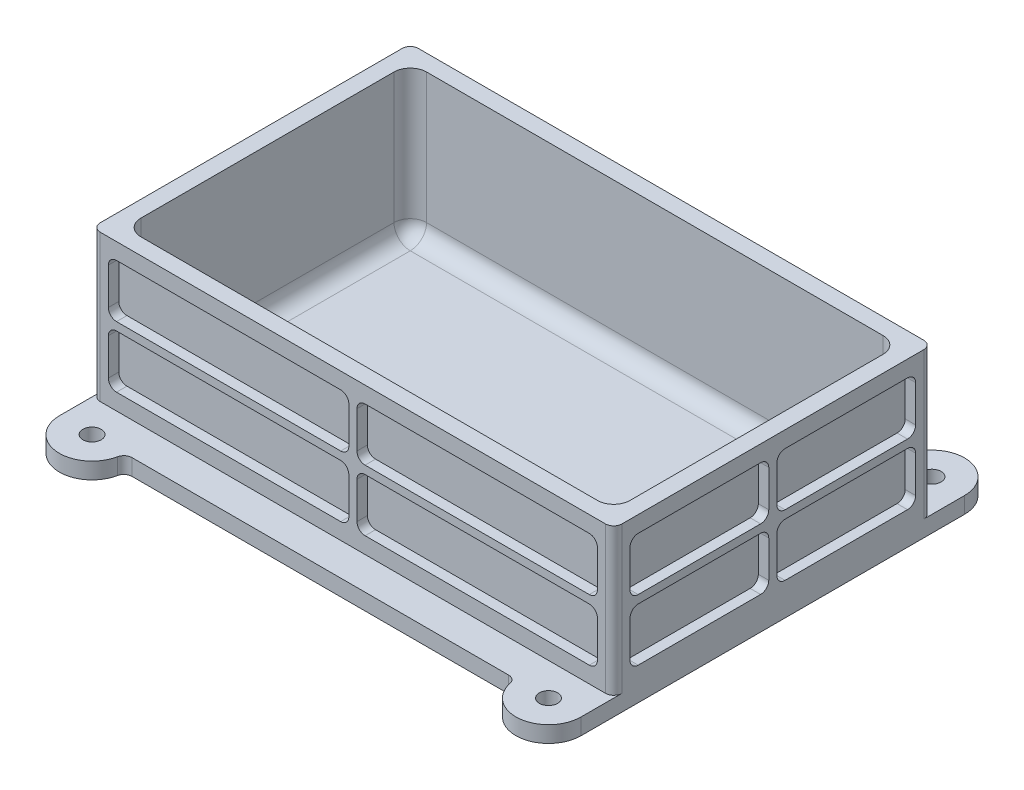
from build123d import *

# Parameters (mm, degrees)
SKETCH2_W                = 203.2
SKETCH2_H                = 123.952
MAIN_BLOCK_DEPTH         = 63.5
SHELL_T                  = -6.35
SKETCH6_W                = 203.2
SKETCH6_H                = 25.4
SKETCH6_R                = 3.5687
MOUNTING_FLANGES_DEPTH   = 6.35
SKETCH7_W                = 93.6625
SKETCH7_H                = 20.6375
LONG_SIDE_RIBBING_DEPTH  = 4.064
SKETCH8_W                = 54.0385
SKETCH8_H                = 20.6375
SHORT_SIDE_RIBBING_DEPTH = 4.064
CUT_EXTRUDE3_DEPTH       = 146.682009445
EXTERNAL_FILLETS_R       = 3.175
INTERNAL_FILLETS_R       = 6.35


with BuildPart() as part:
    # Sketch2 → Main Block (new body)
    with BuildSketch(Plane(origin=(0, 0, 0), x_dir=(1, 0, 0), z_dir=(0, 1, 0))):
        Rectangle(SKETCH2_W, SKETCH2_H)
    extrude(amount=MAIN_BLOCK_DEPTH)

    # Shell
    shell_openings = [part.faces().sort_by_distance(p)[0] for p in [
        (0, 63.5, 0),
    ]]
    offset(amount=SHELL_T, openings=shell_openings, kind=Kind.INTERSECTION)

    # Sketch6 → Mounting Flanges (add)
    # profile 1 of 2: a face of its own
    with BuildSketch(Plane(origin=(0, 6.35, 0), x_dir=(1, 0, 0), z_dir=(0, 1, 0))):
        with Locations((0, 74.676)):
            Rectangle(SKETCH6_W, SKETCH6_H)
        with Locations(Location((-88.9, 74.676, 0), (0, 0, 270))):
            Circle(SKETCH6_R, mode=Mode.SUBTRACT)
        with Locations(Location((88.9, 74.676, 0), (0, 0, 270))):
            Circle(SKETCH6_R, mode=Mode.SUBTRACT)
    # profile 2 of 2: a face of its own
    with BuildSketch(Plane(origin=(0, 6.35, 0), x_dir=(1, 0, 0), z_dir=(0, 1, 0))):
        with Locations((0, -74.676)):
            Rectangle(SKETCH6_W, SKETCH6_H)
        with Locations(Location((88.9, -74.676, 0), (0, 0, 270))):
            Circle(SKETCH6_R, mode=Mode.SUBTRACT)
        with Locations(Location((-88.9, -74.676, 0), (0, 0, 270))):
            Circle(SKETCH6_R, mode=Mode.SUBTRACT)
    extrude(amount=-MOUNTING_FLANGES_DEPTH)

    # Sketch7 → Long Side Ribbing (cut)
    with BuildSketch(Plane.XY.offset(61.976)):
        with Locations((-48.41875, 46.83125)):
            Rectangle(SKETCH7_W, SKETCH7_H)
        with Locations((-48.41875, 23.01875)):
            Rectangle(SKETCH7_W, SKETCH7_H)
        with Locations((48.41875, 46.83125)):
            Rectangle(SKETCH7_W, SKETCH7_H)
        with Locations((48.41875, 23.01875)):
            Rectangle(SKETCH7_W, SKETCH7_H)
    long_side_ribbing = extrude(amount=-LONG_SIDE_RIBBING_DEPTH, mode=Mode.SUBTRACT)

    # Mirror1: Long Side Ribbing across plane
    add(long_side_ribbing.mirror(Plane.XY), mode=Mode.SUBTRACT)

    # Sketch8 → Short Side Ribbing (cut)
    with BuildSketch(Plane(origin=(101.6, 0, 0), x_dir=(0, 0, -1), z_dir=(1, 0, 0))):
        with Locations((-28.60675, 46.83125)):
            Rectangle(SKETCH8_W, SKETCH8_H)
        with Locations((-28.60675, 23.01875)):
            Rectangle(SKETCH8_W, SKETCH8_H)
        with Locations((28.60675, 46.83125)):
            Rectangle(SKETCH8_W, SKETCH8_H)
        with Locations((28.60675, 23.01875)):
            Rectangle(SKETCH8_W, SKETCH8_H)
    short_side_ribbing = extrude(amount=-SHORT_SIDE_RIBBING_DEPTH, mode=Mode.SUBTRACT)

    # Mirror2: Short Side Ribbing across plane
    add(short_side_ribbing.mirror(Plane(origin=(0, 0, 0), x_dir=(0, 0, 1), z_dir=(1, 0, 0))), mode=Mode.SUBTRACT)

    # Sketch9 → Cut-Extrude3 (cut, through all)
    with BuildSketch(Plane(origin=(0, 6.35, 0), x_dir=(1, 0, 0), z_dir=(0, 1, 0))):
        with BuildLine():
            Line((-76.2, -74.676), (76.2, -74.676))
            ThreePointArc((76.2, -74.676), (88.9, -87.376), (101.6, -74.676))
            Line((101.6, -74.676), (112.766741687, -74.676))
            Line((112.766741687, -74.676), (112.766741687, -100.051204048))
            Line((112.766741687, -100.051204048), (-114.105219333, -100.051204048))
            Line((-114.105219333, -100.051204048), (-114.105219333, -74.676))
            Line((-114.105219333, -74.676), (-101.6, -74.676))
            ThreePointArc((-101.6, -74.676), (-88.9, -87.376), (-76.2, -74.676))
        make_face()
    cut_extrude3 = extrude(amount=-CUT_EXTRUDE3_DEPTH, mode=Mode.SUBTRACT)

    # Mirror3: Cut-Extrude3 across plane
    add(cut_extrude3.mirror(Plane.XY), mode=Mode.SUBTRACT)

    # External Fillets
    external_fillets_edges = [part.edges().sort_by_distance(p)[0] for p in [
        (95.25, 57.15, -59.944),
        (1.5875, 57.15, -59.944),
        (1.5875, 36.5125, -59.944),
        (95.25, 36.5125, -59.944),
        (-95.25, 33.3375, -59.944),
        (-95.25, 12.7, -59.944),
        (-1.5875, 12.7, -59.944),
        (-1.5875, 33.3375, -59.944),
        (95.25, 12.7, -59.944),
        (95.25, 33.3375, -59.944),
        (1.5875, 33.3375, -59.944),
        (1.5875, 12.7, -59.944),
        (-95.25, 57.15, -59.944),
        (-95.25, 36.5125, -59.944),
        (-1.5875, 36.5125, -59.944),
        (-1.5875, 57.15, -59.944),
        (99.568, 57.15, -1.5875),
        (99.568, 57.15, -55.626),
        (99.568, 36.5125, -55.626),
        (99.568, 36.5125, -1.5875),
        (99.568, 12.7, 55.626),
        (99.568, 33.3375, 55.626),
        (99.568, 33.3375, 1.5875),
        (99.568, 12.7, 1.5875),
        (99.568, 12.7, -55.626),
        (99.568, 12.7, -1.5875),
        (99.568, 33.3375, -1.5875),
        (99.568, 33.3375, -55.626),
        (99.568, 36.5125, 55.626),
        (99.568, 57.15, 55.626),
        (99.568, 57.15, 1.5875),
        (99.568, 36.5125, 1.5875),
        (-99.568, 57.15, -55.626),
        (-99.568, 57.15, -1.5875),
        (-99.568, 36.5125, -1.5875),
        (-99.568, 36.5125, -55.626),
        (-99.568, 33.3375, 55.626),
        (-99.568, 12.7, 55.626),
        (-99.568, 12.7, 1.5875),
        (-99.568, 33.3375, 1.5875),
        (-99.568, 12.7, -1.5875),
        (-99.568, 12.7, -55.626),
        (-99.568, 33.3375, -55.626),
        (-99.568, 33.3375, -1.5875),
        (-99.568, 57.15, 55.626),
        (-99.568, 36.5125, 55.626),
        (-99.568, 36.5125, 1.5875),
        (-99.568, 57.15, 1.5875),
        (76.2, 3.175, 74.676),
        (-76.2, 3.175, 74.676),
        (-76.2, 3.175, -74.676),
        (76.2, 3.175, -74.676),
        (1.5875, 57.15, 59.944),
        (95.25, 57.15, 59.944),
        (95.25, 36.5125, 59.944),
        (1.5875, 36.5125, 59.944),
        (-95.25, 12.7, 59.944),
        (-95.25, 33.3375, 59.944),
        (-1.5875, 33.3375, 59.944),
        (-1.5875, 12.7, 59.944),
        (-101.6, 34.925, -61.976),
        (95.25, 33.3375, 59.944),
        (95.25, 12.7, 59.944),
        (101.6, 34.925, -61.976),
        (1.5875, 12.7, 59.944),
        (1.5875, 33.3375, 59.944),
        (101.6, 34.925, 61.976),
        (-101.6, 34.925, 61.976),
        (-95.25, 36.5125, 59.944),
        (-95.25, 57.15, 59.944),
        (-1.5875, 57.15, 59.944),
        (-1.5875, 36.5125, 59.944),
    ]]
    fillet(external_fillets_edges, radius=EXTERNAL_FILLETS_R)

    # Internal Fillets
    internal_fillets_edges = [part.edges().sort_by_distance(p)[0] for p in [
        (-95.25, 6.35, 0),
        (-95.25, 34.925, -55.626),
        (0, 6.35, 55.626),
        (-95.25, 34.925, 55.626),
        (95.25, 6.35, 0),
        (95.25, 34.925, 55.626),
        (0, 6.35, -55.626),
        (95.25, 34.925, -55.626),
    ]]
    fillet(internal_fillets_edges, radius=INTERNAL_FILLETS_R)


solid = part.part
